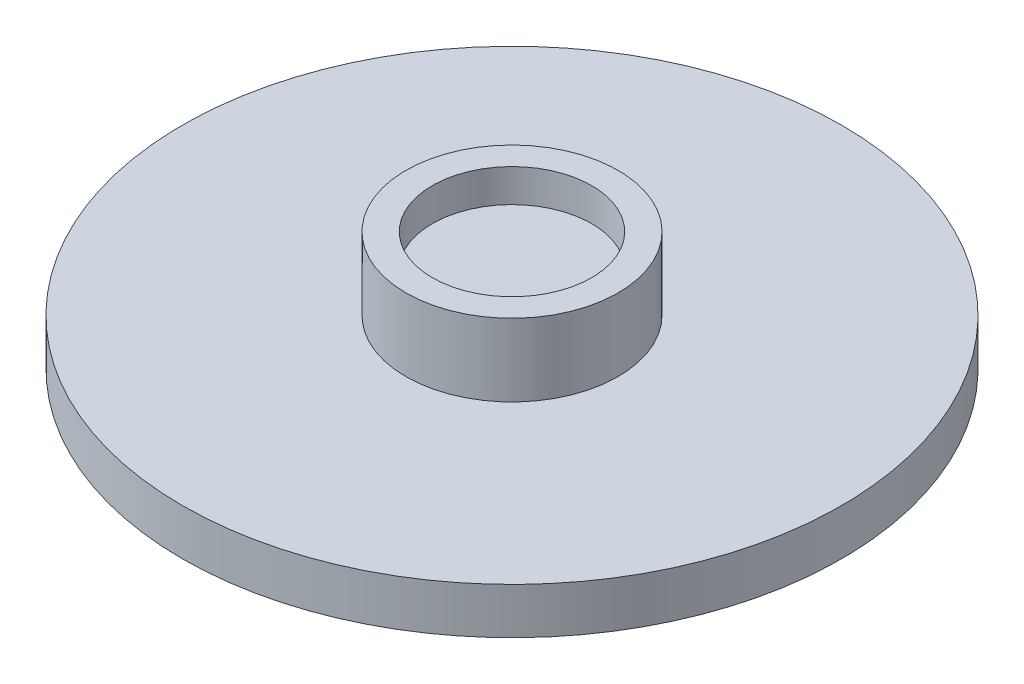
from build123d import *

# Parameters (mm, degrees)
SKETCH1_R           = 25
BOSS_EXTRUDE1_DEPTH = 3.5
SKETCH2_R           = 8.05
SKETCH2_R_2         = 6.05
BOSS_EXTRUDE2_DEPTH = 5.5
SKETCH3_R           = 6.15
BOSS_EXTRUDE3_DEPTH = 3


with BuildPart() as part:
    # Sketch1 → Boss-Extrude1 (new body)
    with BuildSketch(Plane(origin=(0, 0, 0), x_dir=(1, 0, 0), z_dir=(0, 1, 0))):
        with Locations(Location((0, 0, 0), (0, 0, 270))):
            Circle(SKETCH1_R)
    extrude(amount=BOSS_EXTRUDE1_DEPTH)

    # Sketch2 → Boss-Extrude2 (add)
    with BuildSketch(Plane(origin=(0, 3.5, 0), x_dir=(1, 0, 0), z_dir=(0, 1, 0))):
        with Locations(Location((0, 0, 0), (0, 0, 270))):
            Circle(SKETCH2_R)
        with Locations(Location((0, 0, 0), (0, 0, 270))):
            Circle(SKETCH2_R_2, mode=Mode.SUBTRACT)
    extrude(amount=BOSS_EXTRUDE2_DEPTH)

    # Sketch3 → Boss-Extrude3 (add)
    with BuildSketch(Plane(origin=(0, 3.5, 0), x_dir=(1, 0, 0), z_dir=(0, 1, 0))):
        Circle(SKETCH3_R)
    extrude(amount=BOSS_EXTRUDE3_DEPTH)


solid = part.part
